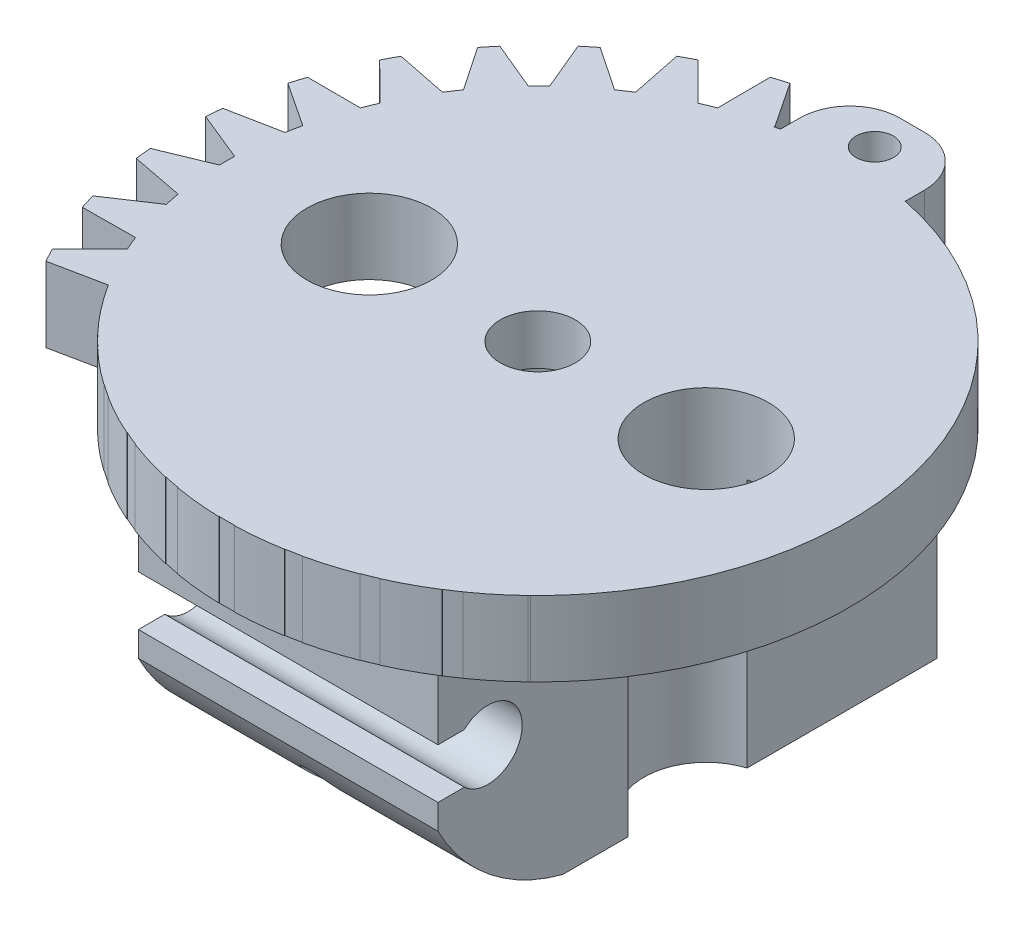
from build123d import *

# Parameters (mm, degrees)
SKETCH1_R               = 5.5
BOSS_EXTRUDE1_DEPTH     = 7
SKETCH2_R               = 3
CUT_EXTRUDE1_DEPTH      = 5
SKETCH3_R               = 10.5
BOSS_EXTRUDE2_DEPTH     = 3
BOSS_EXTRUDE3_DEPTH     = 3
SKETCH6_W               = 12
SKETCH6_H               = 20
BOSS_EXTRUDE4_DEPTH     = 10
CUT_EXTRUDE3_DEPTH      = 29.247125691
CUT_EXTRUDE3_DEPTH_BACK = 29.247125691
CUT_EXTRUDE4_DEPTH      = 29.247125691
CUT_EXTRUDE4_DEPTH_BACK = 29.247125691
CUT_EXTRUDE6_DEPTH      = 32.215381773
CUT_EXTRUDE6_DEPTH_BACK = 32.215381773
SKETCH10_R              = 0.75
CUT_EXTRUDE9_DEPTH      = 10
SKETCH14_R              = 0.75
BOSS_EXTRUDE5_DEPTH     = 3
CUT_EXTRUDE2_DEPTH      = 24.106026223
CUT_EXTRUDE2_DEPTH_BACK = 24.106026223
SKETCH5_R               = 3
CUT_EXTRUDE10_START     = -7
SKETCH17_R              = 5.5
CUT_EXTRUDE10_DEPTH     = 7
SKETCH18_R              = 5.143028801
SKETCH18_R_2            = 1.5
BOSS_EXTRUDE6_DEPTH     = 2
SKETCH19_R              = 2.5
CUT_EXTRUDE11_DEPTH     = 25.553786845


with BuildPart() as part:
    # Sketch1 → Boss-Extrude1 (new body)
    with BuildSketch(Plane(origin=(0, 0, 0), x_dir=(1, 0, 0), z_dir=(0, 1, 0))):
        with Locations(Location((0, 0, 0), (0, 0, 270))):
            Circle(SKETCH1_R)
    extrude(amount=BOSS_EXTRUDE1_DEPTH)

    # Sketch2 → Cut-Extrude1 (cut)
    with BuildSketch(Plane(origin=(0, 7, 0), x_dir=(1, 0, 0), z_dir=(0, 1, 0))):
        with Locations(Location((0, 0, 0), (0, 0, 270))):
            Circle(SKETCH2_R)
    extrude(amount=-CUT_EXTRUDE1_DEPTH, mode=Mode.SUBTRACT)

    # Sketch3 → Boss-Extrude2 (add)
    with BuildSketch(Plane.XZ):
        with Locations(Location((0, 0, 0), (0, 0, 270))):
            Circle(SKETCH3_R)
    extrude(amount=BOSS_EXTRUDE2_DEPTH)



with BuildPart() as body_2:
    # Sketch4 → Boss-Extrude3 (new body)
    with BuildSketch(Plane.XZ.offset(3)):
        with BuildLine():
            Line((2.736209331, 12.158039162), (3.910472421, 13.924200371))
            ThreePointArc((3.910472421, 13.924200371), (4.214262083, 13.835647145), (4.516047029, 13.740485809))
            Line((4.516047029, 13.740485809), (4.504601886, 11.622094636))
            ThreePointArc((4.504601886, 11.622094636), (4.785412065, 11.509822362), (5.063423964, 11.390789577))
            Line((5.063423964, 11.390789577), (6.559684877, 12.893927129))
            ThreePointArc((6.559684877, 12.893927129), (6.840361429, 12.747809005), (7.117782605, 12.595600846))
            Line((7.117782605, 12.595600846), (6.693279762, 10.520146802))
            ThreePointArc((6.693279762, 10.520146802), (6.946791018, 10.35524846), (7.196238852, 10.184265425))
            Line((7.196238852, 10.184265425), (8.95699712, 11.366614588))
            ThreePointArc((8.95699712, 11.366614588), (9.203774319, 11.168546804), (9.446170586, 10.965141094))
            Line((9.446170586, 10.965141094), (8.624923448, 9.012382714))
            ThreePointArc((8.624923448, 9.012382714), (8.841393486, 8.801195255), (9.052691114, 8.584832753))
            Line((9.052691114, 8.584832753), (11.010281785, 9.400956511))
            ThreePointArc((11.010281785, 9.400956511), (11.213676121, 9.158550701), (11.411732327, 8.911764209))
            Line((11.411732327, 8.911764209), (10.225300961, 7.156744902))
            ThreePointArc((10.225300961, 7.156744902), (10.396410958, 6.907384142), (10.561438332, 6.653956862))
            Line((10.561438332, 6.653956862), (12.640632293, 7.072492036))
            ThreePointArc((12.640632293, 7.072492036), (12.792827437, 6.795063719), (12.938932393, 6.514380312))
            Line((12.938932393, 6.514380312), (11.432910691, 5.024544486))
            ThreePointArc((11.432910691, 5.024544486), (11.552084986, 4.746593218), (11.664500196, 4.465840229))
            Line((11.664500196, 4.465840229), (13.78539519, 4.470702748))
            ThreePointArc((13.78539519, 4.470702748), (13.880542367, 4.168913338), (13.96908134, 3.865119521))
            Line((13.96908134, 3.865119521), (12.201344873, 2.697720732))
            ThreePointArc((12.201344873, 2.697720732), (12.264003665, 2.401860468), (12.319486656, 2.10457095))
            Line((12.319486656, 2.10457095), (14.400577879, 1.695573949))
            ThreePointArc((14.400577879, 1.695573949), (14.435020636, 1.381021045), (14.462591124, 1.065791444))
            Line((14.462591124, 1.065791444), (12.501073011, 0.265692172))
            ThreePointArc((12.501073011, 0.265692172), (12.504808358, -0.036707344), (12.501226952, -0.339108722))
            Line((12.501226952, -0.339108722), (14.462539233, -1.146247717))
            ThreePointArc((14.462539233, -1.146247717), (14.434953956, -1.461476024), (14.40049644, -1.776027312))
            Line((14.40049644, -1.776027312), (12.320576723, -2.1780797))
            ThreePointArc((12.320576723, -2.1780797), (12.265245077, -2.475397424), (12.202736904, -2.771289547))
            Line((12.202736904, -2.771289547), (13.968898114, -3.945552637))
            ThreePointArc((13.968898114, -3.945552637), (13.880344888, -4.2493423), (13.785183552, -4.551127245))
            Line((13.785183552, -4.551127245), (11.666792379, -4.539682102))
            ThreePointArc((11.666792379, -4.539682102), (11.554520105, -4.820492281), (11.435487319, -5.09850418))
            Line((11.435487319, -5.09850418), (12.938624872, -6.594765093))
            ThreePointArc((12.938624872, -6.594765093), (12.792506748, -6.875441645), (12.640298588, -7.152862822))
            Line((12.640298588, -7.152862822), (10.564844544, -6.728359978))
            ThreePointArc((10.564844544, -6.728359978), (10.399946202, -6.981871234), (10.228963168, -7.231319068))
            Line((10.228963168, -7.231319068), (11.41131233, -8.992077336))
            ThreePointArc((11.41131233, -8.992077336), (11.213244546, -9.238854535), (11.009838837, -9.481250803))
            Line((11.009838837, -9.481250803), (9.057080457, -8.660003665))
            ThreePointArc((9.057080457, -8.660003665), (8.845892998, -8.876473702), (8.629530496, -9.08777133))
            Line((8.629530496, -9.08777133), (9.445654254, -11.045362001))
            ThreePointArc((9.445654254, -11.045362001), (9.203248443, -11.248756338), (8.956461952, -11.446812543))
            Line((8.956461952, -11.446812543), (7.201442645, -10.260381178))
            ThreePointArc((7.201442645, -10.260381178), (6.952081884, -10.431491175), (6.698654605, -10.596518548))
            Line((6.698654605, -10.596518548), (7.117189779, -12.67571251))
            ThreePointArc((7.117189779, -12.67571251), (6.839761462, -12.827907654), (6.559078054, -12.974012609))
            Line((6.559078054, -12.974012609), (5.069242229, -11.467990907))
            ThreePointArc((5.069242229, -11.467990907), (4.791290961, -11.587165203), (4.510537972, -11.699580412))
            Line((4.510537972, -11.699580412), (4.515400491, -13.820475406))
            ThreePointArc((4.515400491, -13.820475406), (4.213611081, -13.915622583), (3.909817264, -14.004161557))
            Line((3.909817264, -14.004161557), (2.742418475, -12.236425089))
            ThreePointArc((2.742418475, -12.236425089), (2.446558211, -12.299083881), (2.149268693, -12.354566873))
            Line((2.149268693, -12.354566873), (1.740271692, -14.435658095))
            ThreePointArc((1.740271692, -14.435658095), (1.425718788, -14.470100853), (1.110489187, -14.497671341))
            Line((1.110489187, -14.497671341), (0.310389914, -12.536153228))
            ThreePointArc((0.310389914, -12.536153228), (0.007990399, -12.539888575), (-0.294410979, -12.536307168))
            Line((-0.294410979, -12.536307168), (-1.101549974, -14.497619449))
            ThreePointArc((-1.101549974, -14.497619449), (-1.416778281, -14.470034172), (-1.731329569, -14.435576656))
            Line((-1.731329569, -14.435576656), (-2.133381958, -12.355656939))
            ThreePointArc((-2.133381958, -12.355656939), (-2.430699682, -12.300325294), (-2.726591804, -12.237817121))
            Line((-2.726591804, -12.237817121), (-3.900854894, -14.00397833))
            ThreePointArc((-3.900854894, -14.00397833), (-4.204644557, -13.915425104), (-4.506429502, -13.820263768))
            Line((-4.506429502, -13.820263768), (-4.49498436, -11.701872595))
            ThreePointArc((-4.49498436, -11.701872595), (-4.775794538, -11.589600321), (-5.053806437, -11.470567535))
            Line((-5.053806437, -11.470567535), (-6.55006735, -12.973705088))
            ThreePointArc((-6.55006735, -12.973705088), (-6.830743903, -12.827586964), (-7.108165079, -12.675378805))
            Line((-7.108165079, -12.675378805), (-6.683662236, -10.599924761))
            ThreePointArc((-6.683662236, -10.599924761), (-6.937173491, -10.435026419), (-7.186621325, -10.264043384))
            Line((-7.186621325, -10.264043384), (-8.947379593, -11.446392547))
            ThreePointArc((-8.947379593, -11.446392547), (-9.194156792, -11.248324763), (-9.43655306, -11.044919053))
            Line((-9.43655306, -11.044919053), (-8.615305922, -9.092160673))
            ThreePointArc((-8.615305922, -9.092160673), (-8.831775959, -8.880973214), (-9.043073588, -8.664610712))
            Line((-9.043073588, -8.664610712), (-11.000664258, -9.48073447))
            ThreePointArc((-11.000664258, -9.48073447), (-11.204058595, -9.238328659), (-11.402114801, -8.991542168))
            Line((-11.402114801, -8.991542168), (-10.215683435, -7.236522861))
            ThreePointArc((-10.215683435, -7.236522861), (-10.386793432, -6.9871621), (-10.551820805, -6.733734821))
            Line((-10.551820805, -6.733734821), (-12.631014767, -7.152269995))
            ThreePointArc((-12.631014767, -7.152269995), (-12.783209911, -6.874841678), (-12.929314866, -6.594158271))
            Line((-12.929314866, -6.594158271), (-11.423293165, -5.104322445))
            ThreePointArc((-11.423293165, -5.104322445), (-11.54246746, -4.826371177), (-11.654882669, -4.545618188))
            Line((-11.654882669, -4.545618188), (-13.775777664, -4.550480707))
            ThreePointArc((-13.775777664, -4.550480707), (-13.870924841, -4.248691297), (-13.959463814, -3.94489748))
            Line((-13.959463814, -3.94489748), (-12.191727346, -2.777498691))
            ThreePointArc((-12.191727346, -2.777498691), (-12.254386138, -2.481638427), (-12.30986913, -2.184348909))
            Line((-12.30986913, -2.184348909), (-14.390960352, -1.775351908))
            ThreePointArc((-14.390960352, -1.775351908), (-14.42540311, -1.460799004), (-14.452973598, -1.145569403))
            Line((-14.452973598, -1.145569403), (-12.491455485, -0.345470131))
            ThreePointArc((-12.491455485, -0.345470131), (-12.495190832, -0.043070615), (-12.491609425, 0.259330763))
            Line((-12.491609425, 0.259330763), (-14.452921707, 1.066469758))
            ThreePointArc((-14.452921707, 1.066469758), (-14.425336429, 1.381698065), (-14.390878914, 1.696249353))
            Line((-14.390878914, 1.696249353), (-12.310959197, 2.098301742))
            ThreePointArc((-12.310959197, 2.098301742), (-12.255627551, 2.395619466), (-12.193119378, 2.691511588))
            Line((-12.193119378, 2.691511588), (-13.959280588, 3.865774678))
            ThreePointArc((-13.959280588, 3.865774678), (-13.870727361, 4.169564341), (-13.775566025, 4.471349286))
            Line((-13.775566025, 4.471349286), (-11.657174852, 4.459904144))
            ThreePointArc((-11.657174852, 4.459904144), (-11.544902578, 4.740714322), (-11.425869793, 5.018726221))
            Line((-11.425869793, 5.018726221), (-12.929007346, 6.514987134))
            ThreePointArc((-12.929007346, 6.514987134), (-12.782889222, 6.795663686), (-12.630681062, 7.073084863))
            Line((-12.630681062, 7.073084863), (-10.555227018, 6.648582019))
            ThreePointArc((-10.555227018, 6.648582019), (-10.390328676, 6.902093275), (-10.219345641, 7.151541109))
            Line((-10.219345641, 7.151541109), (-11.401694804, 8.912299377))
            ThreePointArc((-11.401694804, 8.912299377), (-11.20362702, 9.159076576), (-11.000221311, 9.401472844))
            Line((-11.000221311, 9.401472844), (-9.04746293, 8.580225706))
            ThreePointArc((-9.04746293, 8.580225706), (-8.836275471, 8.796695743), (-8.619912969, 9.007993371))
            Line((-8.619912969, 9.007993371), (-9.436036727, 10.965584042))
            ThreePointArc((-9.436036727, 10.965584042), (-9.193630917, 11.168978379), (-8.946844425, 11.367034585))
            Line((-8.946844425, 11.367034585), (-7.191825118, 10.180603219))
            ThreePointArc((-7.191825118, 10.180603219), (-6.942464358, 10.351713216), (-6.689037078, 10.516740589))
            Line((-6.689037078, 10.516740589), (-7.107572253, 12.595934551))
            ThreePointArc((-7.107572253, 12.595934551), (-6.830143935, 12.748129695), (-6.549460528, 12.89423465))
            Line((-6.549460528, 12.89423465), (-5.059624702, 11.388212948))
            ThreePointArc((-5.059624702, 11.388212948), (-4.781673434, 11.507387244), (-4.500920446, 11.619802453))
            Line((-4.500920446, 11.619802453), (-4.505782964, 13.740697447))
            ThreePointArc((-4.505782964, 13.740697447), (-4.203993555, 13.835844625), (-3.900199737, 13.924383598))
            Line((-3.900199737, 13.924383598), (-2.732800948, 12.15664713))
            ThreePointArc((-2.732800948, 12.15664713), (-2.436940684, 12.219305922), (-2.139651166, 12.274788914))
            Line((-2.139651166, 12.274788914), (-1.730654165, 14.355880136))
            ThreePointArc((-1.730654165, 14.355880136), (-1.416101261, 14.390322894), (-1.10087166, 14.417893382))
            Line((-1.10087166, 14.417893382), (-0.300772388, 12.456375269))
            ThreePointArc((-0.300772388, 12.456375269), (0.001627128, 12.460110616), (0.304028506, 12.456529209))
            Line((0.304028506, 12.456529209), (1.1111675, 14.417841491))
            ThreePointArc((1.1111675, 14.417841491), (1.426395808, 14.390256213), (1.740947096, 14.355798697))
            Line((1.740947096, 14.355798697), (2.142999484, 12.27587898))
            ThreePointArc((2.142999484, 12.27587898), (2.440317208, 12.220547335), (2.736209331, 12.158039162))
        make_face()
    extrude(amount=-BOSS_EXTRUDE3_DEPTH)


with BuildPart() as part_1:
    add(part.part)

    add(body_2.part)  # Boss-Extrude4 merges body 2
    # Sketch6 → Boss-Extrude4 (add)
    with BuildSketch(Plane.XZ.offset(3)):
        Rectangle(SKETCH6_W, SKETCH6_H)
    extrude(amount=BOSS_EXTRUDE4_DEPTH)

    # Sketch7 → Cut-Extrude3 (cut, two sides: drawn at the far end of the back side and taken through both)
    with BuildSketch(Plane.ZY.offset(6).offset(-CUT_EXTRUDE3_DEPTH_BACK)):
        with BuildLine():
            Line((8, -8), (8, -7))
            Line((8, -7), (8, -6))
            Line((8, -6), (8.943729304, -6))
            ThreePointArc((8.943729304, -6), (6.625, -7), (8.943729304, -8))
            Line((8.943729304, -8), (8, -8))
        make_face()
        with BuildLine():
            Line((9.375, -7), (8, -7))
            Line((8, -7), (8, -8))
            Line((8, -8), (8.943729304, -8))
            ThreePointArc((8.943729304, -8), (9.262587184, -7.544516853), (9.375, -7))
        make_face()
        with BuildLine():
            Line((8, -6), (8, -7))
            Line((8, -7), (9.375, -7))
            ThreePointArc((9.375, -7), (9.262587184, -6.455483147), (8.943729304, -6))
            Line((8.943729304, -6), (8, -6))
        make_face()
        with BuildLine():
            Line((10, -7), (9.375, -7))
            ThreePointArc((9.375, -7), (9.262587184, -7.544516853), (8.943729304, -8))
            Line((8.943729304, -8), (10, -8))
            Line((10, -8), (10, -7))
        make_face()
        with BuildLine():
            ThreePointArc((8.943729304, -6), (9.262587184, -6.455483147), (9.375, -7))
            Line((9.375, -7), (10, -7))
            Line((10, -7), (10, -6))
            Line((10, -6), (8.943729304, -6))
        make_face()
    extrude(amount=CUT_EXTRUDE3_DEPTH + CUT_EXTRUDE3_DEPTH_BACK, mode=Mode.SUBTRACT)

    # Sketch8 → Cut-Extrude4 (cut, two sides: drawn at the far end of the back side and taken through both)
    with BuildSketch(Plane.ZY.offset(6).offset(-CUT_EXTRUDE4_DEPTH_BACK)):
        with BuildLine():
            Line((10, -9), (10, -13))
            Line((10, -13), (5, -13))
            ThreePointArc((5, -13), (7.927069529, -11.533836911), (10, -9))
        make_face()
    extrude(amount=CUT_EXTRUDE4_DEPTH + CUT_EXTRUDE4_DEPTH_BACK, mode=Mode.SUBTRACT)

    # Sketch10 → Cut-Extrude6 (cut, two sides: drawn at the far end of the back side and taken through both)
    with BuildSketch(Plane(origin=(0, 0, -10), x_dir=(-1, 0, 0), z_dir=(0, 0, -1)).offset(-CUT_EXTRUDE6_DEPTH_BACK)):
        with Locations((0, -11)):
            Circle(SKETCH10_R)
    extrude(amount=CUT_EXTRUDE6_DEPTH + CUT_EXTRUDE6_DEPTH_BACK, mode=Mode.SUBTRACT)

    # Sketch12 → Cut-Extrude9 (cut)
    with BuildSketch(Plane.XZ.offset(3)):
        with BuildLine():
            Line((-2.712837204, -12.17608207), (-3.341641779, -14.998358358))
            ThreePointArc((-3.341641779, -14.998358358), (14.30689288, 5.606258944), (-12.641783232, 8.735138233))
            Line((-12.641783232, 8.735138233), (-10.555227018, 6.648582019))
            ThreePointArc((-10.555227018, 6.648582019), (11.515310528, 4.797299626), (-2.712837204, -12.17608207))
        make_face()
    extrude(amount=-CUT_EXTRUDE9_DEPTH, mode=Mode.SUBTRACT)

    # Sketch14 → Boss-Extrude5 (add)
    with BuildSketch(Plane.XZ.offset(3)):
        with BuildLine():
            Line((-2.5, 0), (2.5, 0))
            Line((2.5, 0), (2.5, -13))
            ThreePointArc((2.5, -13), (1.914213562, -14.414213562), (0.5, -15))
            Line((0.5, -15), (-0.5, -15))
            ThreePointArc((-0.5, -15), (-1.914213562, -14.414213562), (-2.5, -13))
            Line((-2.5, -13), (-2.5, 0))
        make_face()
        with Locations(Location((0, -13.5, 0), (0, 0, 270))):
            Circle(SKETCH14_R, mode=Mode.SUBTRACT)
    extrude(amount=-BOSS_EXTRUDE5_DEPTH)

    # Sketch5 → Cut-Extrude2 (cut, two sides: drawn at the far end of the back side and taken through both)
    with BuildSketch(Plane.XZ.offset(3).offset(-CUT_EXTRUDE2_DEPTH_BACK)):
        with Locations(Location((0, 0, 0), (0, 0, 90))):
            Circle(SKETCH5_R)
    extrude(amount=CUT_EXTRUDE2_DEPTH + CUT_EXTRUDE2_DEPTH_BACK, mode=Mode.SUBTRACT)

    # Sketch17 → Cut-Extrude10 (cut)
    with BuildSketch(Plane(origin=(0, 7, 0), x_dir=(1, 0, 0), z_dir=(0, 1, 0)).offset(CUT_EXTRUDE10_START)):
        Circle(SKETCH17_R)
    extrude(amount=CUT_EXTRUDE10_DEPTH, mode=Mode.SUBTRACT)

    # Sketch18 → Boss-Extrude6 (add)
    with BuildSketch(Plane(origin=(0, 0, 0), x_dir=(1, 0, 0), z_dir=(0, 1, 0))):
        Circle(SKETCH18_R)
        with Locations(Location((0, 0, 0), (0, 0, 270))):
            Circle(SKETCH18_R_2, mode=Mode.SUBTRACT)
    extrude(amount=-BOSS_EXTRUDE6_DEPTH)

    # Sketch19 → Cut-Extrude11 (cut, through all)
    with BuildSketch(Plane(origin=(0, 0, 0), x_dir=(1, 0, 0), z_dir=(0, 1, 0))):
        with Locations(Location((-6.75, 0, 0), (0, 0, 270))):
            Circle(SKETCH19_R)
        with Locations(Location((6.75, 0, 0), (0, 0, 270))):
            Circle(SKETCH19_R)
    extrude(amount=-CUT_EXTRUDE11_DEPTH, mode=Mode.SUBTRACT)


solid = part_1.part
